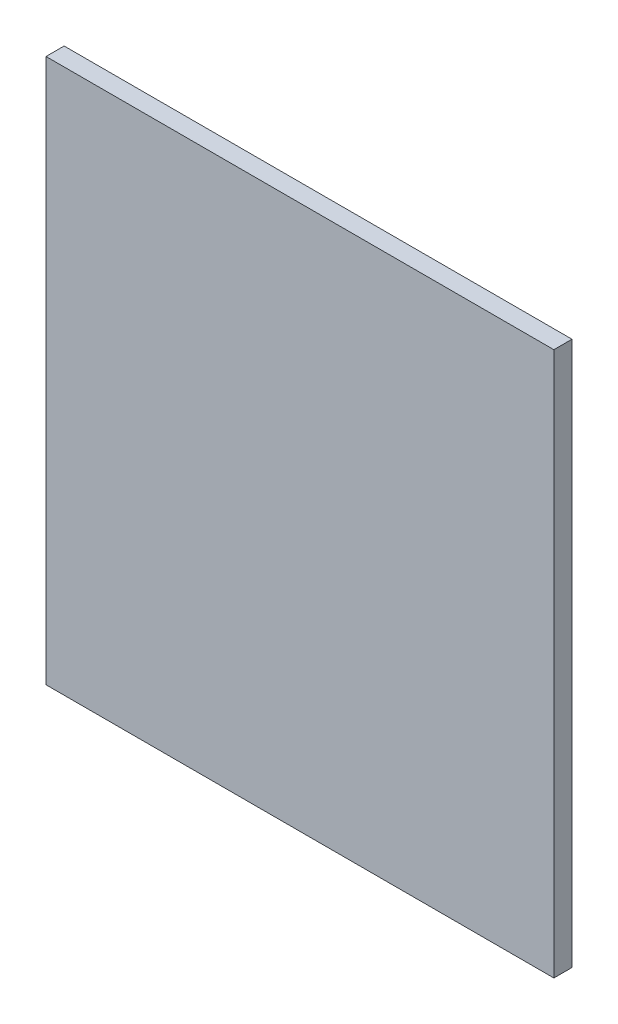
from build123d import *

# Parameters (mm, degrees)
SKETCH1_W           = 71.12
SKETCH1_H           = 76.2
BOSS_EXTRUDE1_DEPTH = 2.54


with BuildPart() as part:
    # Sketch1 → Boss-Extrude1 (new body)
    with BuildSketch(Plane.XY):
        with Locations((-8.677704695, -10.373229612)):
            Rectangle(SKETCH1_W, SKETCH1_H)
    extrude(amount=BOSS_EXTRUDE1_DEPTH)


solid = part.part
